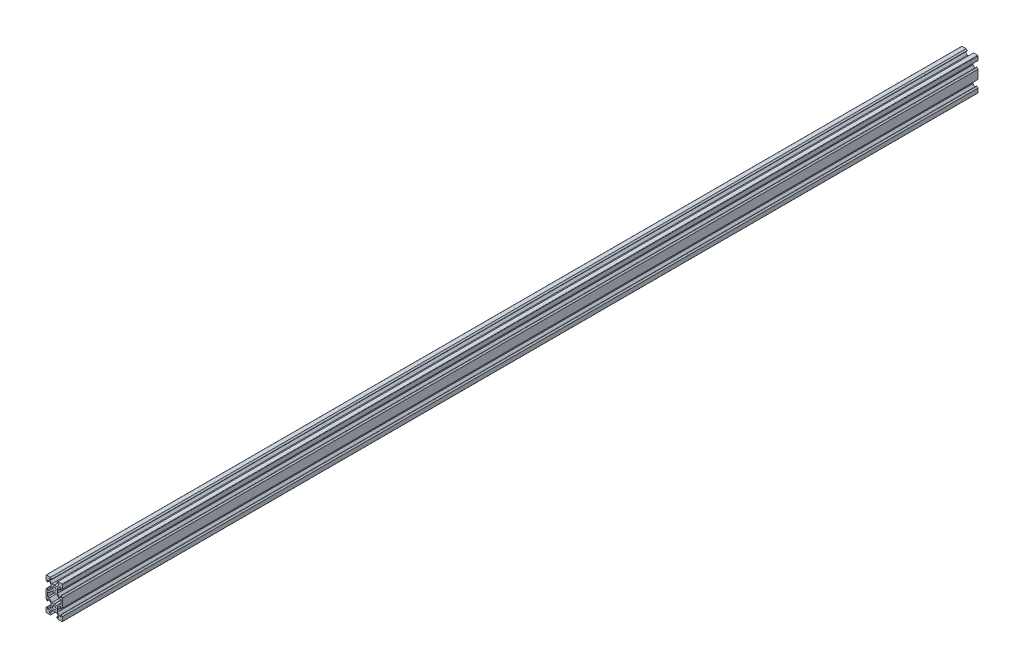
from build123d import *
from build123d.topology import SkipClean

# Parameters (mm, degrees)
BOSS_EXTRU_1_DEPTH     = 1120
SYM_TRIE6_COPY_1_DEPTH = 1120


with BuildPart() as part:
    # Esquisse1 → Boss.-Extru.1 (new body)
    with BuildSketch(Plane.XY):
        with BuildLine():
            Line((-9.5, 10), (-4.58, 10))
            Line((-4.58, 10), (-3.125, 8.545))
            Line((-3.125, 8.545), (-3.125, 8.2))
            Line((-3.125, 8.2), (-5.5, 8.2))
            Line((-5.5, 8.2), (-5.5, 6.560660172))
            Line((-5.5, 6.560660172), (-2.839339828, 3.9))
            Line((-2.839339828, 3.9), (-0.21, 3.9))
            Line((-0.21, 3.9), (0, 3.69))
            Line((0, 3.69), (0, 2.1))
            ThreePointArc((0, 2.1), (-2.1, 0), (0, -2.1))
            Line((0, -2.1), (0, -3.69))
            Line((0, -3.69), (-0.21, -3.9))
            Line((-0.21, -3.9), (-2.839339828, -3.9))
            Line((-2.839339828, -3.9), (-6.239339828, -7.3))
            Line((-6.239339828, -7.3), (-8.2, -7.3))
            Line((-8.2, -7.3), (-8.2, -10))
            Line((-8.2, -10), (-10, -10))
            Line((-10, -10), (-10, -4.58))
            Line((-10, -4.58), (-8.545, -3.125))
            Line((-8.545, -3.125), (-8.2, -3.125))
            Line((-8.2, -3.125), (-8.2, -5.5))
            Line((-8.2, -5.5), (-6.560660172, -5.5))
            Line((-6.560660172, -5.5), (-3.9, -2.839339828))
            Line((-3.9, -2.839339828), (-3.9, -0.21))
            Line((-3.9, -0.21), (-3.69, 0))
            Line((-3.69, 0), (-3.9, 0.21))
            Line((-3.9, 0.21), (-3.9, 2.839339828))
            Line((-3.9, 2.839339828), (-6.560660172, 5.5))
            Line((-6.560660172, 5.5), (-8.2, 5.5))
            Line((-8.2, 5.5), (-8.2, 3.125))
            Line((-8.2, 3.125), (-8.545, 3.125))
            Line((-8.545, 3.125), (-10, 4.58))
            Line((-10, 4.58), (-10, 9.5))
            ThreePointArc((-10, 9.5), (-9.853553391, 9.853553391), (-9.5, 10))
        make_face()
    boss_extru_1 = extrude(amount=BOSS_EXTRU_1_DEPTH)

    # Symétrie1: Boss.-Extru.1 across plane
    add(boss_extru_1.mirror(Plane(origin=(0, 3.69, 1120), x_dir=(0, 0, 1), z_dir=(-1, 0, 0))))

    # Symétrie6: Boss.-Extru.1 across plane
    add(boss_extru_1.mirror(Plane(origin=(-8.2, -10, 1120), x_dir=(0, 0, 1), z_dir=(0, 1, 0))))

    # Symétrie6 copy 1 sketch → Symétrie6 copy 1 (add)
    with SkipClean():  # the faces are left unmerged after this step: merging them gives an invalid solid
        with BuildSketch(Plane(origin=(0, -20, 0), x_dir=(-1, 0, 0), z_dir=(0, 0, 1))):
            with BuildLine():
                Line((-9.5, 10), (-4.58, 10))
                Line((-4.58, 10), (-3.125, 8.545))
                Line((-3.125, 8.545), (-3.125, 8.2))
                Line((-3.125, 8.2), (-5.5, 8.2))
                Line((-5.5, 8.2), (-5.5, 6.560660172))
                Line((-5.5, 6.560660172), (-2.839339828, 3.9))
                Line((-2.839339828, 3.9), (-0.21, 3.9))
                Line((-0.21, 3.9), (0, 3.69))
                Line((0, 3.69), (0, 2.1))
                ThreePointArc((0, 2.1), (-2.1, 0), (0, -2.1))
                Line((0, -2.1), (0, -3.69))
                Line((0, -3.69), (-0.21, -3.9))
                Line((-0.21, -3.9), (-2.839339828, -3.9))
                Line((-2.839339828, -3.9), (-6.239339828, -7.3))
                Line((-6.239339828, -7.3), (-8.2, -7.3))
                Line((-8.2, -7.3), (-8.2, -10))
                Line((-8.2, -10), (-10, -10))
                Line((-10, -10), (-10, -4.58))
                Line((-10, -4.58), (-8.545, -3.125))
                Line((-8.545, -3.125), (-8.2, -3.125))
                Line((-8.2, -3.125), (-8.2, -5.5))
                Line((-8.2, -5.5), (-6.560660172, -5.5))
                Line((-6.560660172, -5.5), (-3.9, -2.839339828))
                Line((-3.9, -2.839339828), (-3.9, -0.21))
                Line((-3.9, -0.21), (-3.69, 0))
                Line((-3.69, 0), (-3.9, 0.21))
                Line((-3.9, 0.21), (-3.9, 2.839339828))
                Line((-3.9, 2.839339828), (-6.560660172, 5.5))
                Line((-6.560660172, 5.5), (-8.2, 5.5))
                Line((-8.2, 5.5), (-8.2, 3.125))
                Line((-8.2, 3.125), (-8.545, 3.125))
                Line((-8.545, 3.125), (-10, 4.58))
                Line((-10, 4.58), (-10, 9.5))
                ThreePointArc((-10, 9.5), (-9.853553391, 9.853553391), (-9.5, 10))
            make_face()
        extrude(amount=SYM_TRIE6_COPY_1_DEPTH)


solid = part.part
